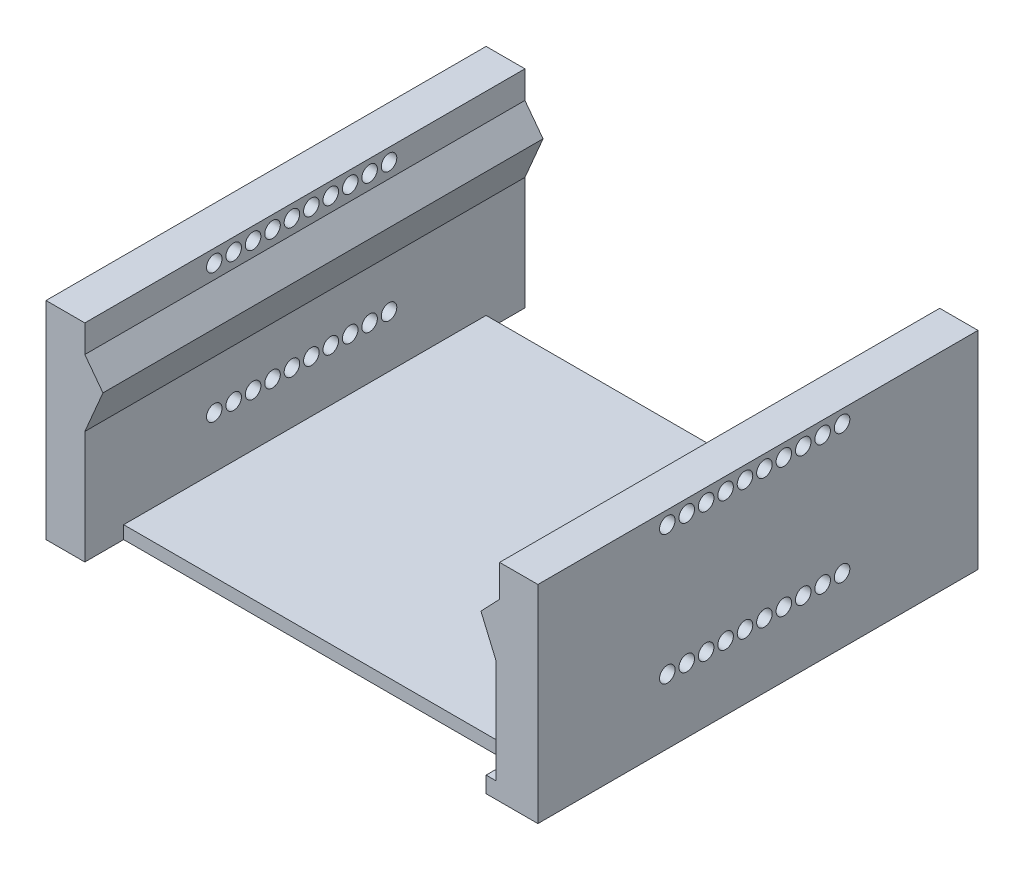
from build123d import *

# Parameters (mm, degrees)
SKETCH1_W           = 32
SKETCH1_H           = 28
BOSS_EXTRUDE1_DEPTH = 1
SKETCH2_W           = 38
SKETCH2_H           = 34
SKETCH2_W_2         = 32
SKETCH2_H_2         = 28
BOSS_EXTRUDE2_DEPTH = 16
SKETCH3_W           = 31
SKETCH3_H           = 3
CUT_EXTRUDE1_DEPTH  = 16
SKETCH4_R           = 0.6
CUT_EXTRUDE2_DEPTH  = 61
BOSS_EXTRUDE3_REACH = 44.107
SKETCH9_R           = 0.6
CUT_EXTRUDE3_DEPTH  = 45
SKETCH10_W          = 20.681714782
SKETCH10_H          = 4.865607423
BOSS_EXTRUDE4_DEPTH = 3
SKETCH11_W          = 20.21758054
SKETCH11_H          = 4.689593046
BOSS_EXTRUDE5_DEPTH = 3
CUT_EXTRUDE5_DEPTH  = 43.107006543


with BuildPart() as part:
    # Sketch1 → Boss-Extrude1 (new body)
    with BuildSketch(Plane(origin=(0, 0, 0), x_dir=(1, 0, 0), z_dir=(0, 1, 0))):
        Rectangle(SKETCH1_W, SKETCH1_H)
    extrude(amount=BOSS_EXTRUDE1_DEPTH)

    # Sketch2 → Boss-Extrude2 (add)
    with BuildSketch(Plane(origin=(0, 0, 0), x_dir=(1, 0, 0), z_dir=(0, 1, 0))):
        Rectangle(SKETCH2_W, SKETCH2_H)
        Rectangle(SKETCH2_W_2, SKETCH2_H_2, mode=Mode.SUBTRACT)
    extrude(amount=BOSS_EXTRUDE2_DEPTH)

    # Sketch3 → Cut-Extrude1 (cut)
    with BuildSketch(Plane(origin=(0, 16, 0), x_dir=(1, 0, 0), z_dir=(0, 1, 0))):
        with Locations((-0.5, 15.5)):
            Rectangle(SKETCH3_W, SKETCH3_H)
        with Locations((-0.5, -15.5)):
            Rectangle(SKETCH3_W, SKETCH3_H)
    extrude(amount=-CUT_EXTRUDE1_DEPTH, mode=Mode.SUBTRACT)

    # Sketch4 → Cut-Extrude2 (cut)
    with BuildSketch(Plane(origin=(19, 0, 0), x_dir=(0, 0, -1), z_dir=(1, 0, 0))):
        with Locations((-7, 15)):
            Circle(SKETCH4_R)
        with Locations((-5.5, 15)):
            Circle(SKETCH4_R)
        with Locations((-4, 15)):
            Circle(SKETCH4_R)
        with Locations((-2.5, 15)):
            Circle(SKETCH4_R)
        with Locations((-1, 15)):
            Circle(SKETCH4_R)
        with Locations((0.5, 15)):
            Circle(SKETCH4_R)
        with Locations((2, 15)):
            Circle(SKETCH4_R)
        with Locations((3.5, 15)):
            Circle(SKETCH4_R)
        with Locations((5, 15)):
            Circle(SKETCH4_R)
        with Locations((6.5, 15)):
            Circle(SKETCH4_R)
        with Locations((-5.5, 10)):
            Circle(SKETCH4_R)
        with Locations((-4, 10)):
            Circle(SKETCH4_R)
        with Locations((-2.5, 10)):
            Circle(SKETCH4_R)
        with Locations((-1, 10)):
            Circle(SKETCH4_R)
        with Locations((0.5, 10)):
            Circle(SKETCH4_R)
        with Locations((2, 10)):
            Circle(SKETCH4_R)
        with Locations((3.5, 10)):
            Circle(SKETCH4_R)
        with Locations((5, 10)):
            Circle(SKETCH4_R)
        with Locations((6.5, 10)):
            Circle(SKETCH4_R)
        with Locations((-7, 10)):
            Circle(SKETCH4_R)
    extrude(amount=-CUT_EXTRUDE2_DEPTH, mode=Mode.SUBTRACT)

    # Boss-Extrude3: up to this face of the body (flat: up to its plane)
    boss_extrude3_end = Plane(part.part.faces().sort_by_distance((-17.5, 8, -17))[0])
    # Sketch6 → Boss-Extrude3 (add, up to the picked face)
    with BuildSketch(Plane.XY.offset(17), mode=Mode.PRIVATE) as boss_extrude3_sk1:
        Polygon((-16, 13.882344073), (-14.6, 12.018654658), (-16, 8.736052102), align=None)
    boss_extrude3_tool1 = split(extrude(boss_extrude3_sk1.sketch, amount=-BOSS_EXTRUDE3_REACH, mode=Mode.PRIVATE), bisect_by=boss_extrude3_end, keep=Keep.BOTH, mode=Mode.PRIVATE)
    # Sketch6 → Boss-Extrude3 (add, up to the picked face)
    with BuildSketch(Plane.XY.offset(17), mode=Mode.PRIVATE) as boss_extrude3_sk2:
        Polygon((14.6, 12.018654658), (16, 8.736052102), (16, 13.882344073), align=None)
    boss_extrude3_tool2 = split(extrude(boss_extrude3_sk2.sketch, amount=-BOSS_EXTRUDE3_REACH, mode=Mode.PRIVATE), bisect_by=boss_extrude3_end, keep=Keep.BOTH, mode=Mode.PRIVATE)
    add(boss_extrude3_tool1.solids().sort_by(Axis((-15.533333, 11.545684, 17), (0, 0, -1)))[0])
    add(boss_extrude3_tool2.solids().sort_by(Axis((15.533333, 11.545684, 17), (0, 0, -1)))[0])

    # Sketch9 → Cut-Extrude3 (cut)
    with BuildSketch(Plane.ZY.offset(19)):
        with Locations((-6.5, 5)):
            Circle(SKETCH9_R)
        with Locations((-5, 5)):
            Circle(SKETCH9_R)
        with Locations((-3.5, 5)):
            Circle(SKETCH9_R)
        with Locations((-2, 5)):
            Circle(SKETCH9_R)
        with Locations((-0.5, 5)):
            Circle(SKETCH9_R)
        with Locations((1, 5)):
            Circle(SKETCH9_R)
        with Locations((2.5, 5)):
            Circle(SKETCH9_R)
        with Locations((4, 5)):
            Circle(SKETCH9_R)
        with Locations((5.5, 5)):
            Circle(SKETCH9_R)
        with Locations((7, 5)):
            Circle(SKETCH9_R)
    extrude(amount=-CUT_EXTRUDE3_DEPTH, mode=Mode.SUBTRACT)

    # Sketch10 → Boss-Extrude4 (add)
    with BuildSketch(Plane.ZY.offset(19)):
        with Locations((1.876379269, 9.706359038)):
            Rectangle(SKETCH10_W, SKETCH10_H)
    extrude(amount=-BOSS_EXTRUDE4_DEPTH)

    # Sketch11 → Boss-Extrude5 (add)
    with BuildSketch(Plane(origin=(19, 0, 0), x_dir=(0, 0, -1), z_dir=(1, 0, 0))):
        with Locations((0.622743722, 10.359232414)):
            Rectangle(SKETCH11_W, SKETCH11_H)
    extrude(amount=-BOSS_EXTRUDE5_DEPTH)

    # Sketch12 → Cut-Extrude5 (cut, through all)
    with BuildSketch(Plane.XY.offset(17)):
        Polygon((14.6, 12.018654658), (16.041364921, 13.52892304), (16.041364921, 16), (15, 16), (13.555828546, 12.018654658), (11.7448085, 12.149887785), (9.441904284, 1.248003239), (15.747668413, 1.248003239), (15.747668413, 9.327698039), (14.882100771, 11.357208436), align=None)
    extrude(amount=-CUT_EXTRUDE5_DEPTH, mode=Mode.SUBTRACT)


solid = part.part
